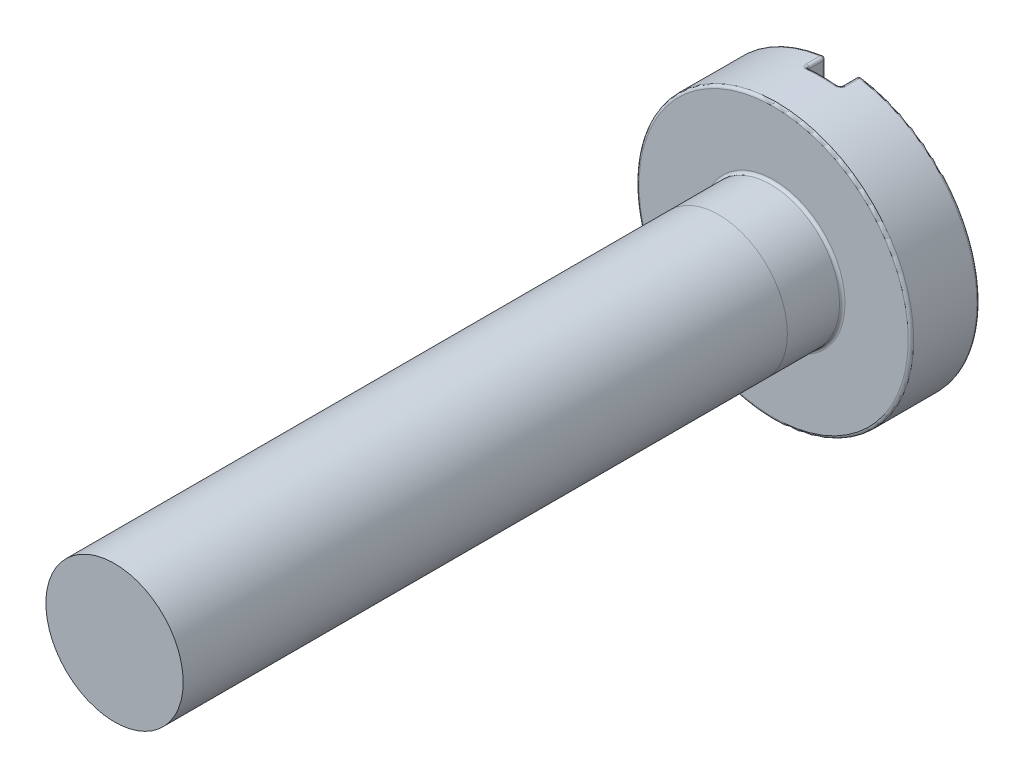
from build123d import *

# Parameters (mm, degrees)
SKETCH1_R           = 1.25
BOSS_EXTRUDE1_DEPTH = 12
SKETCH2_R           = 2.5
BOSS_EXTRUDE2_DEPTH = 1.25
SKETCH3_W           = 0.6
SKETCH3_H           = 13.562630166
CUT_EXTRUDE1_DEPTH  = 0.35
FILLET1_R           = 0.05
FILLET2_R           = 0.05


with BuildPart() as part:
    # Sketch1 → Boss-Extrude1 (new body)
    with BuildSketch(Plane.XY):
        Circle(SKETCH1_R)
    extrude(amount=BOSS_EXTRUDE1_DEPTH)

    # Sketch2 → Boss-Extrude2 (add)
    with BuildSketch(Plane.XY):
        Circle(SKETCH2_R)
    extrude(amount=-BOSS_EXTRUDE2_DEPTH)

    # Sketch3 → Cut-Extrude1 (cut)
    with BuildSketch(Plane(origin=(0, 0, -1.25), x_dir=(-1, 0, 0), z_dir=(0, 0, -1))):
        Rectangle(SKETCH3_W, SKETCH3_H)
    extrude(amount=-CUT_EXTRUDE1_DEPTH, mode=Mode.SUBTRACT)

    # Fillet1
    fillet1_edges = [part.edges().sort_by_distance(p)[0] for p in [
        (1.870828693, -1.658312395, -1.25),
        (-0.3, 0, -1.25),
        (0.3, 0, -1.25),
        (0, 2.5, -0.9),
        (0, -2.5, -0.9),
        (0.3, 2.481934729, -1.075),
        (0.3, -2.481934729, -1.075),
        (-0.3, -2.481934729, -1.075),
        (-0.3, 2.481934729, -1.075),
        (0.3, 0, -0.9),
        (-0.3, 0, -0.9),
        (-2.5, 0, -1.25),
    ]]
    fillet(fillet1_edges, radius=FILLET1_R)

    # Fillet2
    fillet2_edges = [part.edges().sort_by_distance(p)[0] for p in [
        (-1.25, 0, 0),
        (-2.5, 0, 0),
    ]]
    fillet(fillet2_edges, radius=FILLET2_R)


solid = part.part
